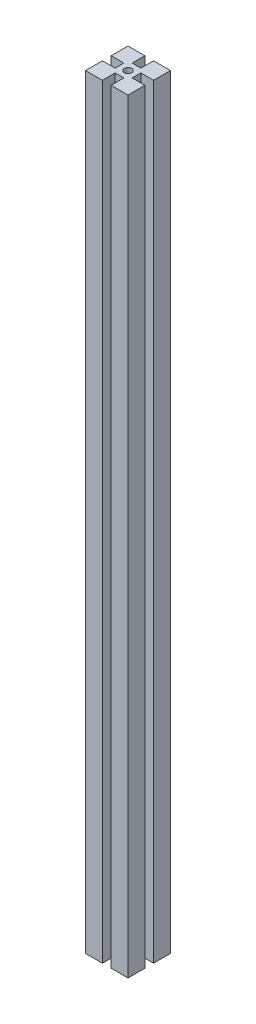
from build123d import *

# Parameters (mm, degrees)
SKIZZE1_R                       = 3.5
AUFSATZ_LINEAR_AUSTRAGEN1_DEPTH = 720


with BuildPart() as part:
    # Skizze1 → Aufsatz-Linear austragen1 (new body)
    with BuildSketch(Plane(origin=(0, 0, 0), x_dir=(1, 0, 0), z_dir=(0, 1, 0))):
        Polygon((-4.1, -20), (-4.1, -8), (4.1, -8), (4.1, -20), (20, -20), (20, -4.1), (8, -4.1), (8, 4.1), (20, 4.1), (20, 20), (4.1, 20), (4.1, 8), (-4.1, 8), (-4.1, 20), (-20, 20), (-20, 4.1), (-8, 4.1), (-8, -4.1), (-20, -4.1), (-20, -20), align=None)
        with Locations(Location((0, 0, 0), (0, 0, 90))):
            Circle(SKIZZE1_R, mode=Mode.SUBTRACT)
    extrude(amount=AUFSATZ_LINEAR_AUSTRAGEN1_DEPTH)


solid = part.part
